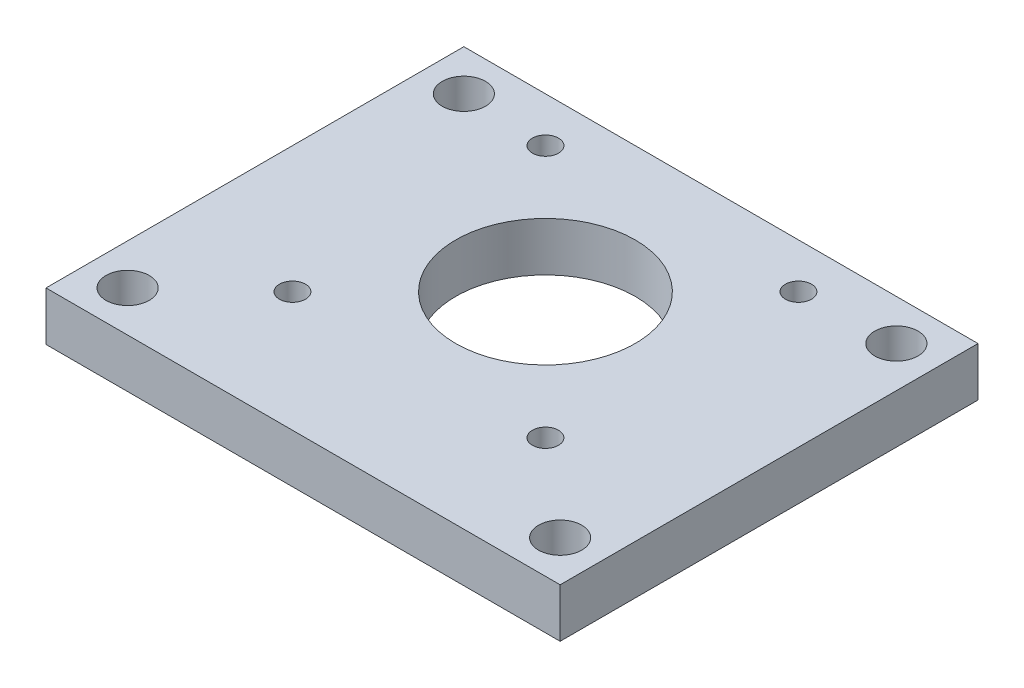
from build123d import *

# Parameters (mm, degrees)
SKETCH1_W                  = 63
SKETCH1_H                  = 51.2
BOSS_EXTRUDE1_DEPTH        = 6
M5_CLEARANCE_HOLE1_D       = 5.3
M3_CLEARANCE_HOLE1_D       = 3.2
F_22_0_22_DIAMETER_HOLE1_D = 22


with BuildPart() as part:
    # Sketch1 → Boss-Extrude1 (new body)
    with BuildSketch(Plane(origin=(0, 0, 0), x_dir=(1, 0, 0), z_dir=(0, 1, 0))):
        with Locations((0.5, -4.6)):
            Rectangle(SKETCH1_W, SKETCH1_H)
    extrude(amount=BOSS_EXTRUDE1_DEPTH)

    # M5 Clearance Hole1 (through all)
    with Locations(Plane(origin=(0, 6, 0), x_dir=(1, 0, 0), z_dir=(0, 1, 0))):
        with Locations((-26, 16), (-26, -25.2), (27, -25.2), (27, 16)):
            Hole(M5_CLEARANCE_HOLE1_D / 2)

    # M3 Clearance Hole1 (through all)
    with Locations(Plane(origin=(0, 6, 0), x_dir=(1, 0, 0), z_dir=(0, 1, 0))):
        with Locations((-15.5, 15.5), (15.5, 15.5), (15.5, -15.5), (-15.5, -15.5)):
            Hole(M3_CLEARANCE_HOLE1_D / 2)

    # Ø22.0 (22) Diameter Hole1 (through all)
    with Locations(Plane(origin=(0, 6, 0), x_dir=(1, 0, 0), z_dir=(0, 1, 0))):
        with Locations((0, 0)):
            Hole(F_22_0_22_DIAMETER_HOLE1_D / 2)


solid = part.part
